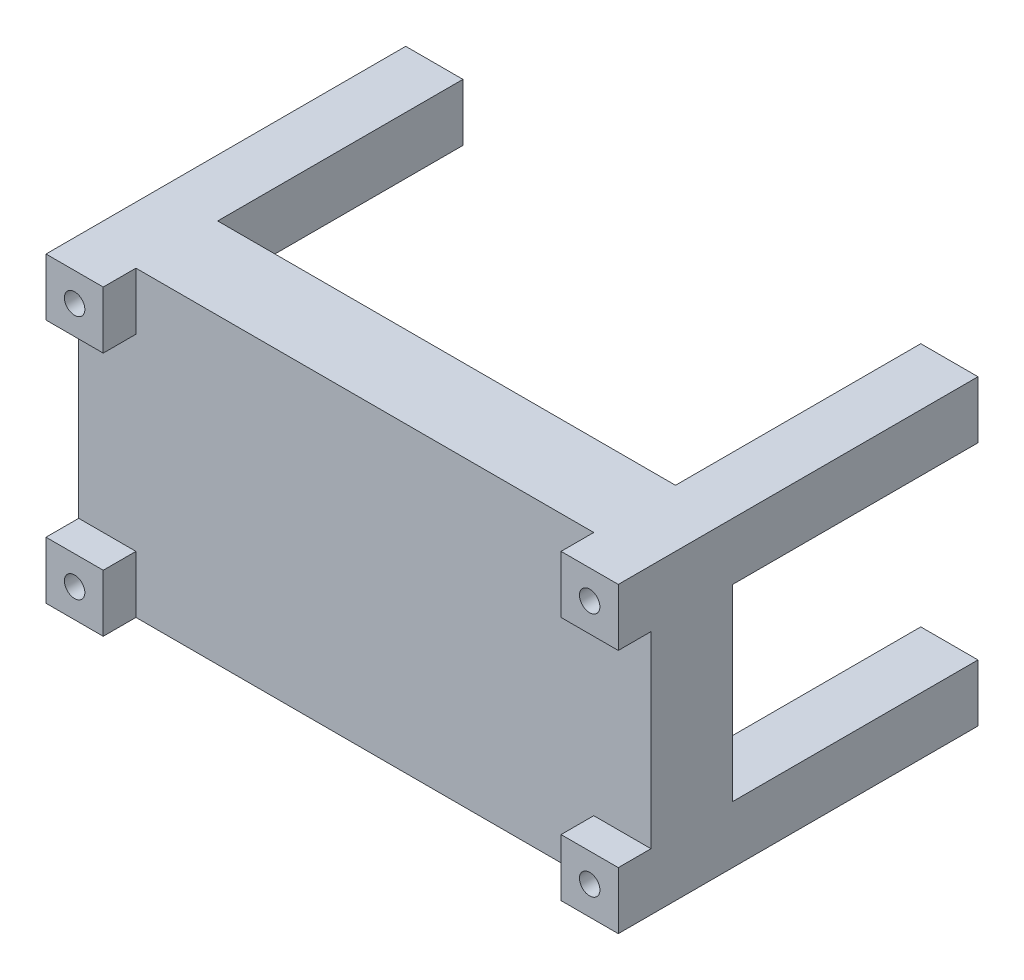
from build123d import *

# Parameters (mm, degrees)
SKETCH1_W                = 70
SKETCH1_H                = 37
BOSS_EXTRUDE1_DEPTH      = 10
BOSS_EXTRUDE4_DEPTH      = 14
BOSS_EXTRUDE4_DEPTH_BACK = 30
SKETCH2_W                = 7
SKETCH2_H                = 7
SKETCH2_R                = 1.25


with BuildPart() as part:
    # Sketch1 → Boss-Extrude1 (new body)
    with BuildSketch(Plane.XY):
        with Locations((35, 18.5)):
            Rectangle(SKETCH1_W, SKETCH1_H)
    extrude(amount=BOSS_EXTRUDE1_DEPTH)

    # Sketch2 → Boss-Extrude4 (add, two sides: drawn at the far end of the back side and taken through both)
    # profile 1 of 4: a face of its own
    with BuildSketch(Plane.XY.offset(-BOSS_EXTRUDE4_DEPTH_BACK)):
        with Locations((3.5, 33.5)):
            Rectangle(SKETCH2_W, SKETCH2_H)
        with Locations((3.5, 33.5)):
            Circle(SKETCH2_R, mode=Mode.SUBTRACT)
    # profile 2 of 4: a face of its own
    with BuildSketch(Plane.XY.offset(-BOSS_EXTRUDE4_DEPTH_BACK)):
        with Locations((66.5, 33.5)):
            Rectangle(SKETCH2_W, SKETCH2_H)
        with Locations((66.5, 33.5)):
            Circle(SKETCH2_R, mode=Mode.SUBTRACT)
    # profile 3 of 4: a face of its own
    with BuildSketch(Plane.XY.offset(-BOSS_EXTRUDE4_DEPTH_BACK)):
        with Locations((66.5, 3.5)):
            Rectangle(SKETCH2_W, SKETCH2_H)
        with Locations((66.5, 3.5)):
            Circle(SKETCH2_R, mode=Mode.SUBTRACT)
    # profile 4 of 4: a face of its own
    with BuildSketch(Plane.XY.offset(-BOSS_EXTRUDE4_DEPTH_BACK)):
        with Locations((3.5, 3.5)):
            Rectangle(SKETCH2_W, SKETCH2_H)
        with Locations((3.5, 3.5)):
            Circle(SKETCH2_R, mode=Mode.SUBTRACT)
    extrude(amount=BOSS_EXTRUDE4_DEPTH + BOSS_EXTRUDE4_DEPTH_BACK)


solid = part.part
